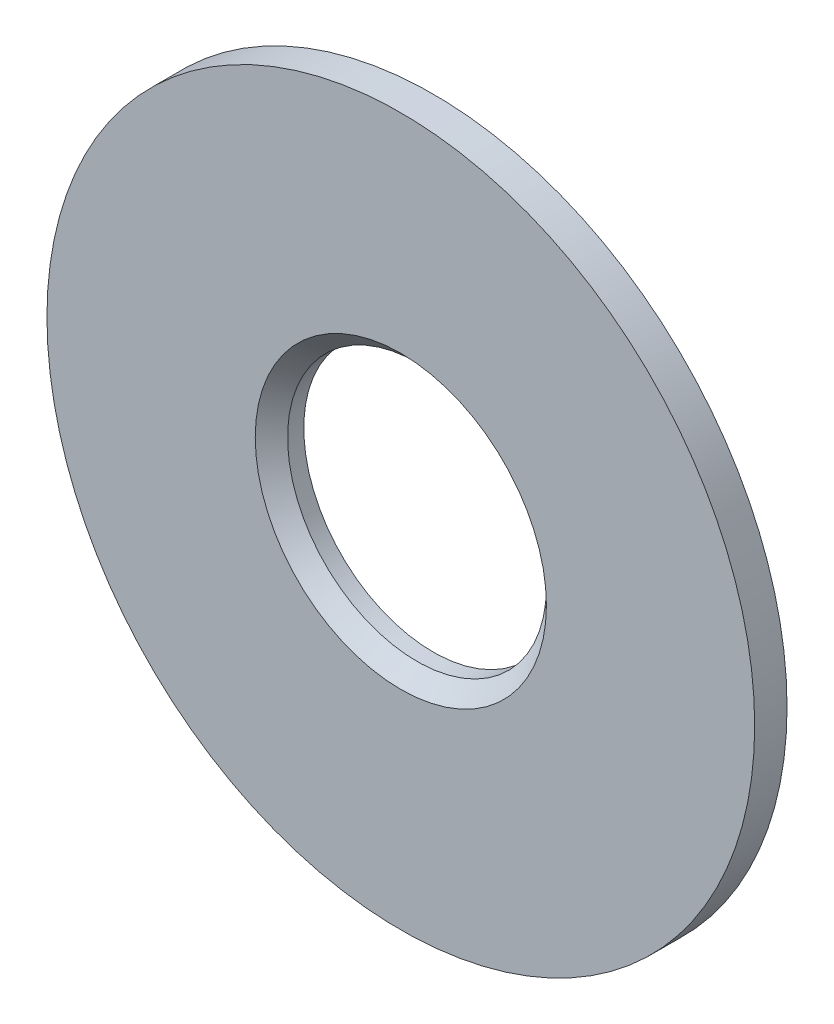
from build123d import *

# Parameters (mm, degrees)
ESBO_O2_R                = 43.75
ESBO_O2_R_2              = 16
RESSALTO_EXTRUS_O1_DEPTH = 4
CHANFRO2_SIZE            = 2


with BuildPart() as part:
    # Esboço2 → Ressalto-extrusão1 (new body)
    with BuildSketch(Plane.XY):
        Circle(ESBO_O2_R)
        Circle(ESBO_O2_R_2, mode=Mode.SUBTRACT)
    extrude(amount=RESSALTO_EXTRUS_O1_DEPTH)

    # Chanfro2
    chanfro2_edges = [part.edges().sort_by_distance(p)[0] for p in [
        (-16, 0, 4),
    ]]
    chamfer(chanfro2_edges, length=CHANFRO2_SIZE)


solid = part.part
